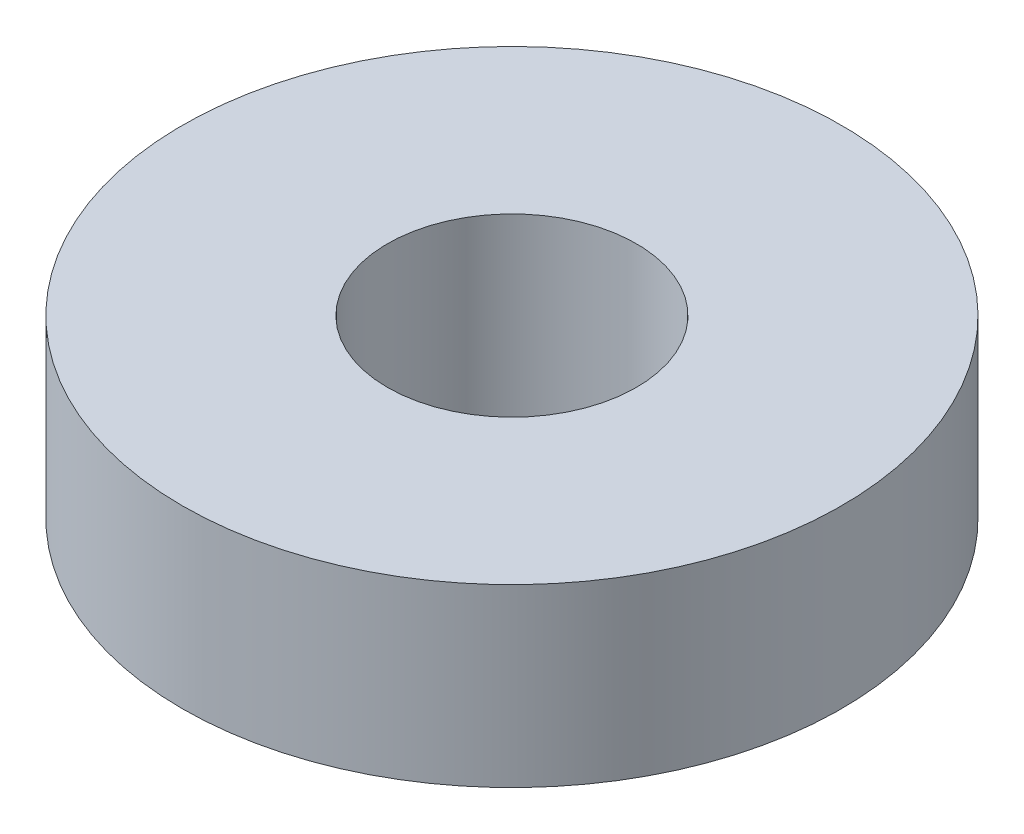
from build123d import *

# Parameters (mm, degrees)
SKETCH1_R           = 22.5
SKETCH1_R_2         = 8.5
BOSS_EXTRUDE1_DEPTH = 12


with BuildPart() as part:
    # Sketch1 → Boss-Extrude1 (new body)
    with BuildSketch(Plane(origin=(0, 0, 0), x_dir=(1, 0, 0), z_dir=(0, 1, 0))):
        with Locations(Location((0, 0, 0), (0, 0, 270))):
            Circle(SKETCH1_R)
        with Locations(Location((0, 0, 0), (0, 0, 270))):
            Circle(SKETCH1_R_2, mode=Mode.SUBTRACT)
    extrude(amount=BOSS_EXTRUDE1_DEPTH)


solid = part.part
